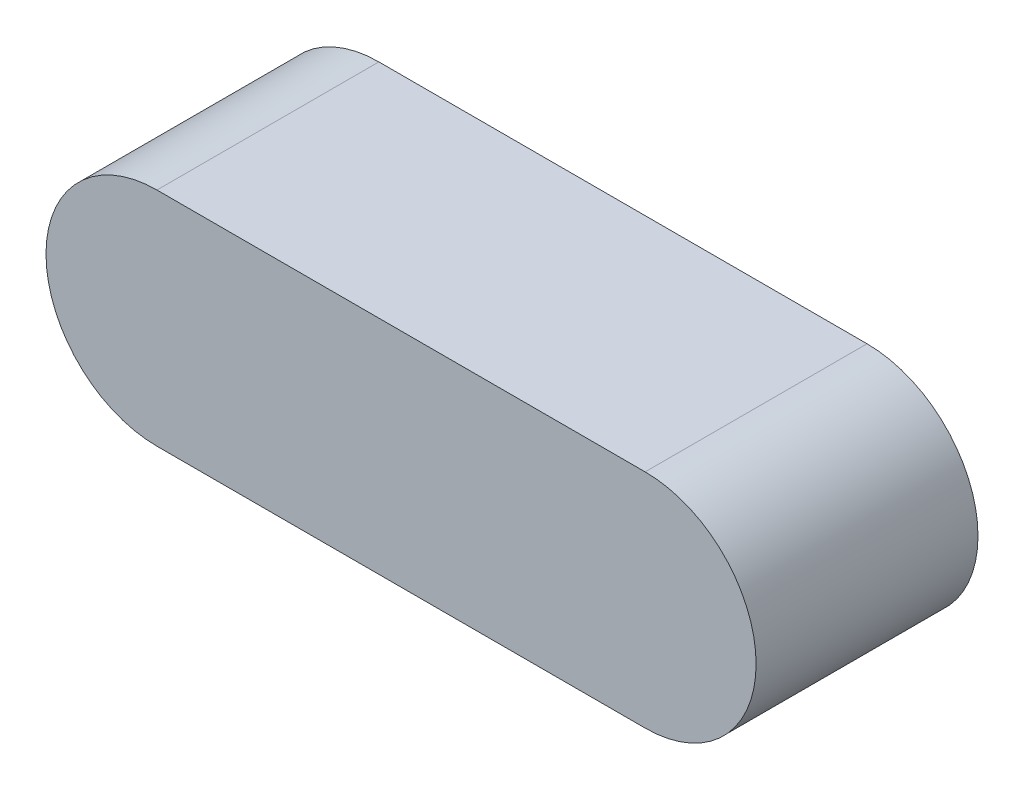
from build123d import *

# Parameters (mm, degrees)
EXTRUDE_1_DEPTH = 5


with BuildPart() as part:
    # 草图1 → 凸台-拉伸1 (new body)
    with BuildSketch(Plane.XY):
        with BuildLine():
            Line((0, 2.5), (11, 2.5))
            ThreePointArc((11, 2.5), (13.5, 0), (11, -2.5))
            Line((11, -2.5), (0, -2.5))
            ThreePointArc((0, -2.5), (-2.5, 0), (0, 2.5))
        make_face()
    extrude(amount=EXTRUDE_1_DEPTH)


solid = part.part
